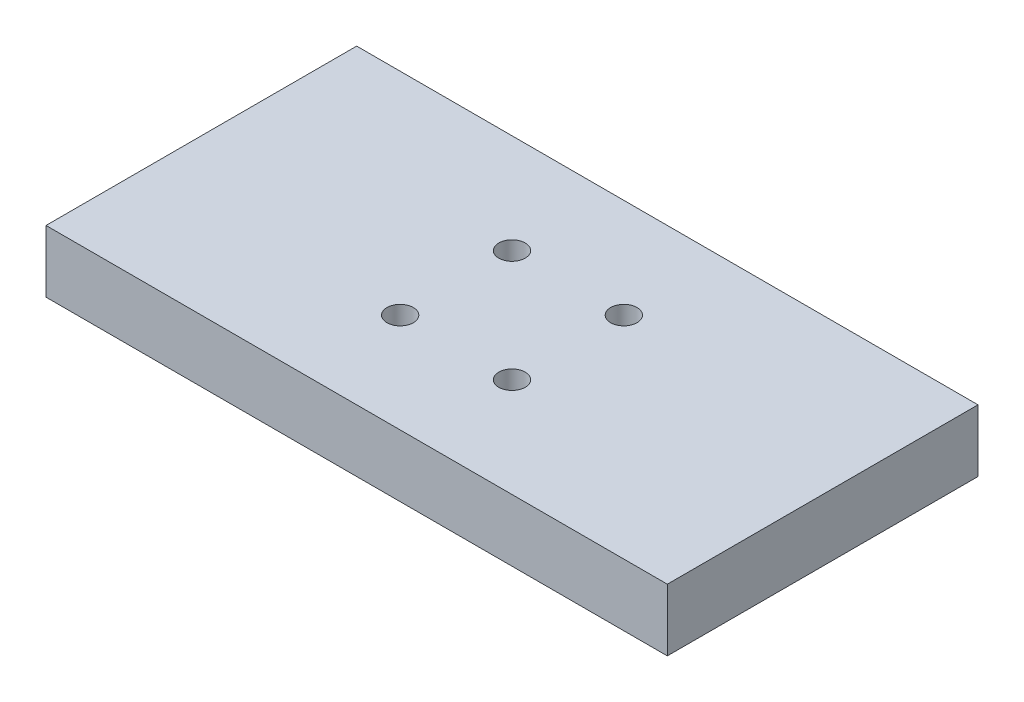
from build123d import *

# Parameters (mm, degrees)
CROQUIS1_W              = 200
CROQUIS1_H              = 100
SALIENTE_EXTRUIR1_DEPTH = 20
CROQUIS2_R              = 7
CORTAR_EXTRUIR1_DEPTH   = 9
CROQUIS3_R              = 4.25
CORTAR_EXTRUIR2_DEPTH   = 113.343224095


with BuildPart() as part:
    # Croquis1 → Saliente-Extruir1 (new body)
    with BuildSketch(Plane(origin=(0, 0, 0), x_dir=(1, 0, 0), z_dir=(0, 1, 0))):
        Rectangle(CROQUIS1_W, CROQUIS1_H)
    extrude(amount=SALIENTE_EXTRUIR1_DEPTH)

    # Croquis2 → Cortar-Extruir1 (cut)
    with BuildSketch(Plane.XZ):
        with Locations(Location((-18, 18, 0), (0, 0, 270))):
            Circle(CROQUIS2_R)
        with Locations(Location((-18, -18, 0), (0, 0, 270))):
            Circle(CROQUIS2_R)
        with Locations(Location((18, 18, 0), (0, 0, 270))):
            Circle(CROQUIS2_R)
        with Locations(Location((18, -18, 0), (0, 0, 270))):
            Circle(CROQUIS2_R)
    extrude(amount=-CORTAR_EXTRUIR1_DEPTH, mode=Mode.SUBTRACT)

    # Croquis3 → Cortar-Extruir2 (cut, through all)
    with BuildSketch(Plane.XZ.offset(-9)):
        with Locations(Location((-18, 18, 0), (0, 0, 270))):
            Circle(CROQUIS3_R)
        with Locations(Location((18, 18, 0), (0, 0, 270))):
            Circle(CROQUIS3_R)
        with Locations(Location((18, -18, 0), (0, 0, 270))):
            Circle(CROQUIS3_R)
        with Locations(Location((-18, -18, 0), (0, 0, 270))):
            Circle(CROQUIS3_R)
    extrude(amount=-CORTAR_EXTRUIR2_DEPTH, mode=Mode.SUBTRACT)


solid = part.part
